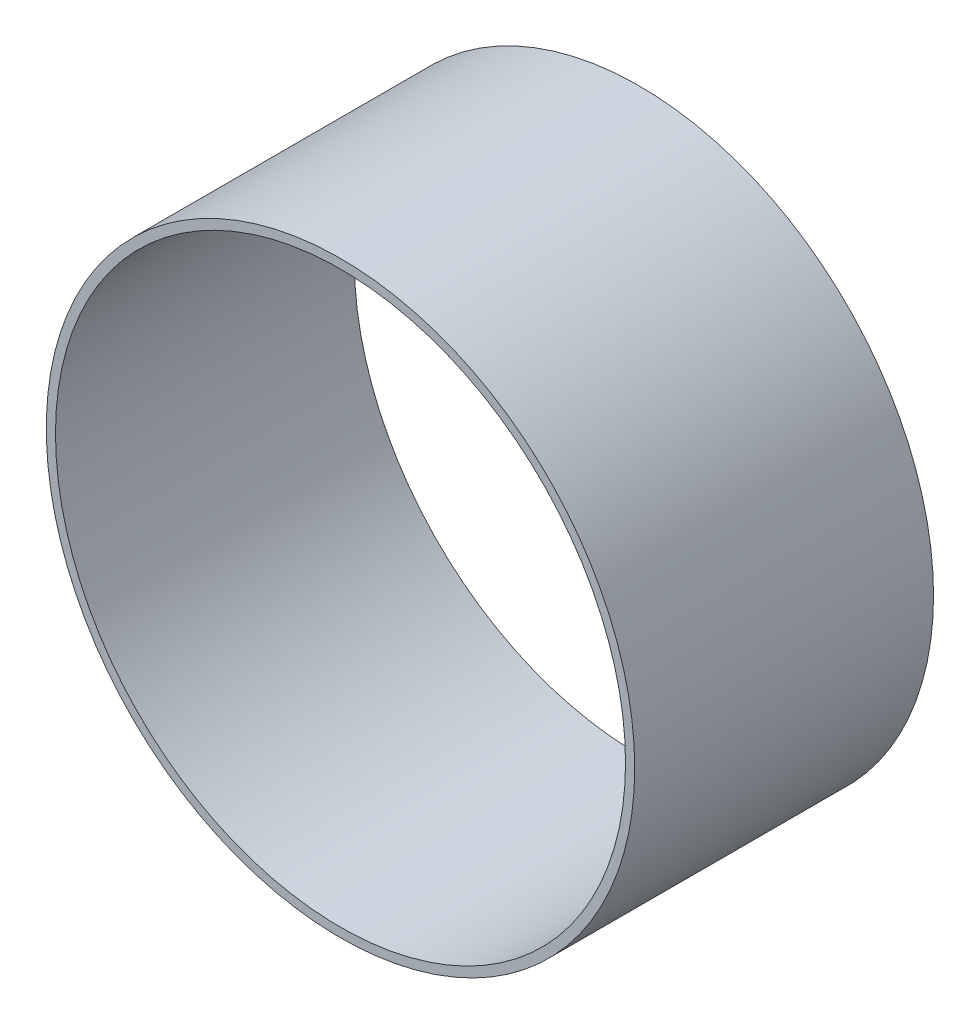
from build123d import *

# Parameters (mm, degrees)
PRINTED_FIXED_CASE_START = -32
SKETCH_1_R               = 64
SKETCH_1_R_2             = 62
PRINTED_FIXED_CASE_DEPTH = 65


with BuildPart() as part:
    # Эскиз1 → Printed_fixed_case (new body)
    with BuildSketch(Plane.XY.offset(PRINTED_FIXED_CASE_START)):
        Circle(SKETCH_1_R)
        Circle(SKETCH_1_R_2, mode=Mode.SUBTRACT)
    extrude(amount=PRINTED_FIXED_CASE_DEPTH)


solid = part.part
